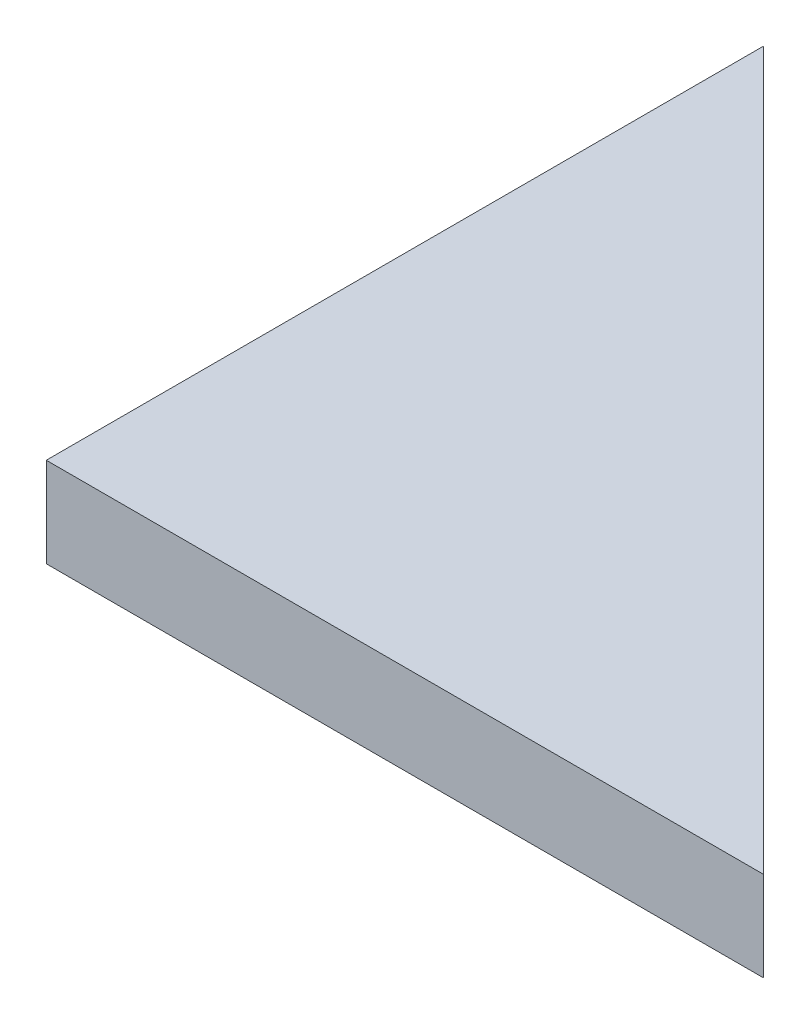
from build123d import *

# Parameters (mm, degrees)
BOSS_EXTRUDE1_DEPTH = 0.1


with BuildPart() as part:
    # Sketch1 → Boss-Extrude1 (new body)
    with BuildSketch(Plane(origin=(0, 0, 0), x_dir=(1, 0, 0), z_dir=(0, 1, 0))):
        Polygon((0, 0), (0, 0.8), (0.8, 0), align=None)
    extrude(amount=BOSS_EXTRUDE1_DEPTH)


solid = part.part
